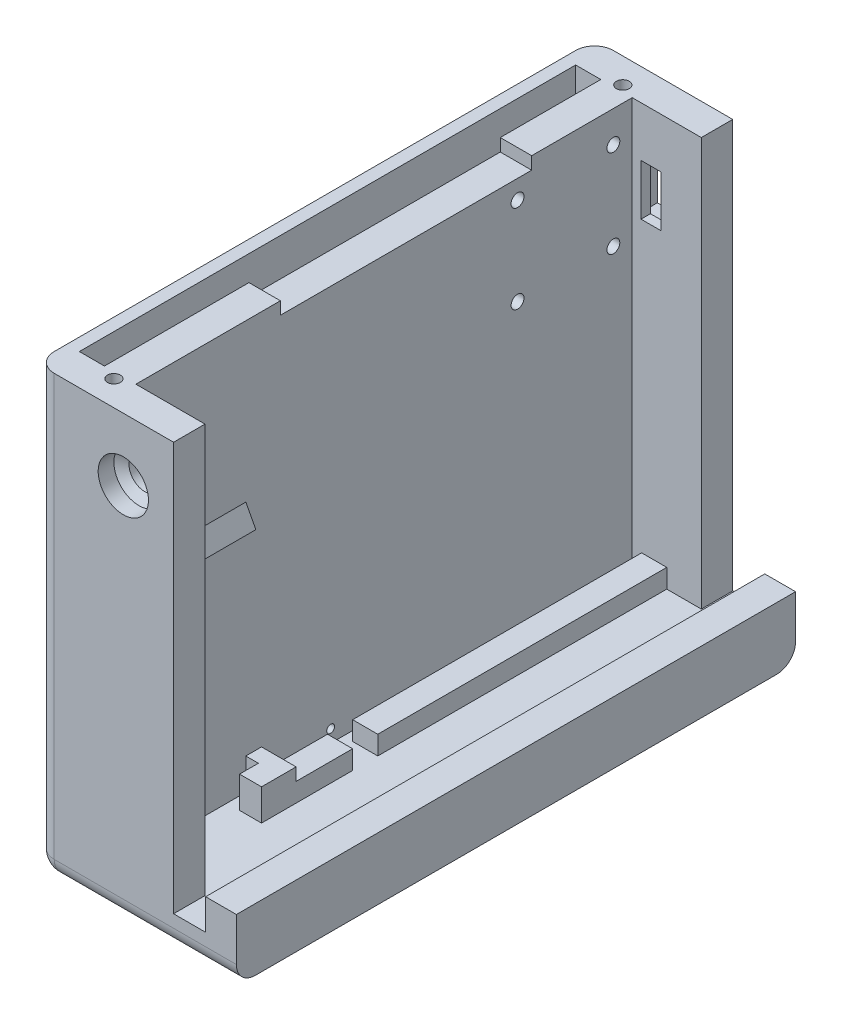
from build123d import *

# Parameters (mm, degrees)
BOSS_EXTRUDE4_DEPTH          = 65
SKETCH5_W                    = 73
SKETCH5_H                    = 7
SKETCH5_H_2                  = 2
BOSS_EXTRUDE5_DEPTH          = 2
CUT_EXTRUDE8_DEPTH           = 111.756489652
CUT_EXTRUDE8_DEPTH_BACK      = 5
SKETCH9_W                    = 5
SKETCH9_H                    = 3
SKETCH9_W_2                  = 2.5
BOSS_EXTRUDE8_DEPTH          = 1.5
SKETCH10_W                   = 66.5
SKETCH10_H                   = 3
BOSS_EXTRUDE9_DEPTH          = 4
M2_5X0_45_TAPPED_HOLE1_D     = 2.05
M2_5X0_45_TAPPED_HOLE1_DEPTH = 3.384117865
M2_5X0_45_TAPPED_HOLE1_TIP   = 0.615882135
SKETCH17_W                   = 11
SKETCH17_H                   = 5
BOSS_EXTRUDE20_DEPTH         = 65
CUT_EXTRUDE10_REACH          = 110.079
SKETCH18_W                   = 8
SKETCH18_H                   = 11
SKETCH20_W                   = 2.5
SKETCH20_H                   = 2
BOSS_EXTRUDE13_DEPTH         = 5.5
SKETCH22_W                   = 3.5
SKETCH22_H                   = 5
BOSS_EXTRUDE21_DEPTH         = 3
SKETCH23_W                   = 3.499642839
SKETCH23_H                   = 5
BOSS_EXTRUDE17_DEPTH         = 3
BOSS_EXTRUDE18_DEPTH         = 17.5
SKETCH27_W                   = 4
SKETCH27_H                   = 3
CUT_EXTRUDE12_DEPTH          = 5.5
M2_5X0_45_TAPPED_HOLE2_D     = 2.05
M2_5X0_45_TAPPED_HOLE2_DEPTH = 4
M2_5X0_45_TAPPED_HOLE2_TIP   = 0.615882135
SKETCH31_W                   = 8
SKETCH31_H                   = 11
SKETCH31_W_2                 = 3.2
SKETCH31_H_2                 = 8.1
BOSS_EXTRUDE22_DEPTH         = 1.5
F_5_0MM_DOWEL_HOLE1_D        = 5
F_5_0MM_DOWEL_HOLE1_DEPTH    = 5
SKETCH36_W                   = 22
SKETCH36_H                   = 89
BOSS_EXTRUDE23_DEPTH         = 5
F_8_0MM_DOWEL_HOLE1_D        = 8
F_8_0MM_DOWEL_HOLE1_DEPTH    = 2.5
F_8_0MM_DOWEL_HOLE1_TIP      = 2.403442476
SKETCH42_W                   = 2
SKETCH42_H                   = 73
BOSS_EXTRUDE25_DEPTH         = 1.5
SKETCH43_W                   = 2
SKETCH43_H                   = 73
CUT_EXTRUDE13_DEPTH          = 1.5
SKETCH44_W                   = 4
SKETCH44_H                   = 79
CUT_EXTRUDE14_DEPTH          = 1.5
SKETCH46_W                   = 5
SKETCH46_H                   = 89
BOSS_EXTRUDE26_DEPTH         = 10
SKETCH46_3_W                 = 5
SKETCH46_3_H                 = 89
BOSS_EXTRUDE27_DEPTH         = 5
FILLET1_R                    = 3
SKETCH47_W                   = 5
SKETCH47_H                   = 89
CUT_EXTRUDE15_DEPTH          = 0.1
SKETCH48_W                   = 89
SKETCH48_H                   = 4.9
CUT_EXTRUDE16_DEPTH          = 0.1


with BuildPart() as part:
    # Sketch4 → Boss-Extrude4 (new body)
    with BuildSketch(Plane(origin=(0, 0, 0), x_dir=(1, 0, 0), z_dir=(0, 1, 0))):
        Polygon((0, 0), (9, 0), (9, 89), (0, 89), (-2, 89), (-2, 81), (0, 81), (0, 84), (4, 84), (4, 5), (0, 5), (0, 8), (-2, 8), (-2, 0), align=None)
    extrude(amount=-BOSS_EXTRUDE4_DEPTH)

    # Sketch5 → Boss-Extrude5 (add)
    with BuildSketch(Plane.ZY.offset(2)):
        with Locations((-44.5, -3.5)):
            Rectangle(SKETCH5_W, SKETCH5_H)
        with Locations((-44.5, -64)):
            Rectangle(SKETCH5_W, SKETCH5_H_2)
    extrude(amount=-BOSS_EXTRUDE5_DEPTH)

    # Sketch8 → Cut-Extrude8 (cut, two sides: drawn at the far end of the back side and taken through both)
    with BuildSketch(Plane(origin=(9, 0, 0), x_dir=(0, 0, -1), z_dir=(1, 0, 0)).offset(-CUT_EXTRUDE8_DEPTH_BACK)):
        Polygon((28, 198.138247042), (28, 0), (28, -2), (68, -2), (68, 0), (68, 198.138247042), (68, 594.414741126), (28, 594.414741126), align=None)
    extrude(amount=CUT_EXTRUDE8_DEPTH + CUT_EXTRUDE8_DEPTH_BACK, mode=Mode.SUBTRACT)

    # Sketch9 → Boss-Extrude8 (add)
    with BuildSketch(Plane(origin=(9, 0, 0), x_dir=(0, 0, -1), z_dir=(1, 0, 0))):
        with Locations((86.5, -63.5)):
            Rectangle(SKETCH9_W, SKETCH9_H)
        with Locations((23.75, -63.5)):
            Rectangle(SKETCH9_W_2, SKETCH9_H)
    extrude(amount=BOSS_EXTRUDE8_DEPTH)

    # Sketch10 → Boss-Extrude9 (add)
    with BuildSketch(Plane(origin=(10.5, 0, 0), x_dir=(0, 0, -1), z_dir=(1, 0, 0))):
        with Locations((55.75, -63.5)):
            Rectangle(SKETCH10_W, SKETCH10_H)
    extrude(amount=BOSS_EXTRUDE9_DEPTH)

    # M2.5x0.45 Tapped Hole1
    with Locations(Plane(origin=(9, 0, 0), x_dir=(0, 0, -1), z_dir=(1, 0, 0))):
        with Locations((81, -5), (65.75, -19), (81, -19), (65.75, -5)):
            Hole(M2_5X0_45_TAPPED_HOLE1_D / 2, depth=M2_5X0_45_TAPPED_HOLE1_DEPTH)
            with Locations((0, 0, -(M2_5X0_45_TAPPED_HOLE1_DEPTH + M2_5X0_45_TAPPED_HOLE1_TIP / 2))):  # 118° drill point
                Cone(0, M2_5X0_45_TAPPED_HOLE1_D / 2, M2_5X0_45_TAPPED_HOLE1_TIP, mode=Mode.SUBTRACT)

    # Sketch17 → Boss-Extrude20 (add)
    with BuildSketch(Plane(origin=(0, 0, 0), x_dir=(1, 0, 0), z_dir=(0, 1, 0))):
        with Locations((14.5, 86.5)):
            Rectangle(SKETCH17_W, SKETCH17_H)
        with Locations((14.5, 2.5)):
            Rectangle(SKETCH17_W, SKETCH17_H)
    extrude(amount=-BOSS_EXTRUDE20_DEPTH)

    # Sketch18 → Cut-Extrude10 (cut, up to next)
    with BuildSketch(Plane.XY.offset(-84), mode=Mode.PRIVATE) as cut_extrude10_sk1:
        with Locations((12, -12)):
            Rectangle(SKETCH18_W, SKETCH18_H)
    cut_extrude10_tool1 = extrude(cut_extrude10_sk1.sketch, amount=-CUT_EXTRUDE10_REACH, mode=Mode.PRIVATE) & part.part
    add(cut_extrude10_tool1.solids().sort_by_distance((12, -12, -84))[0], mode=Mode.SUBTRACT)

    # Sketch20 → Boss-Extrude13 (add)
    with BuildSketch(Plane(origin=(9, 0, 0), x_dir=(0, 0, -1), z_dir=(1, 0, 0))):
        with Locations((23.75, -61)):
            Rectangle(SKETCH20_W, SKETCH20_H)
    extrude(amount=BOSS_EXTRUDE13_DEPTH)

    # Sketch22 → Boss-Extrude21 (add)
    with BuildSketch(Plane.XY.offset(-22.5)):
        with Locations((12.75, -62.5)):
            Rectangle(SKETCH22_W, SKETCH22_H)
    extrude(amount=BOSS_EXTRUDE21_DEPTH)

    # Sketch23 → Boss-Extrude17 (add)
    with BuildSketch(Plane(origin=(0, 0, -5), x_dir=(-1, 0, 0), z_dir=(0, 0, -1))):
        with Locations((-12.74982142, -62.5)):
            Rectangle(SKETCH23_W, SKETCH23_H)
    extrude(amount=BOSS_EXTRUDE17_DEPTH)

    # Sketch24 → Boss-Extrude18 (add)
    with BuildSketch(Plane(origin=(0, 0, -5), x_dir=(-1, 0, 0), z_dir=(0, 0, -1))):
        Polygon((-9, -25), (-10.6, -28), (-9, -28), align=None)
    extrude(amount=BOSS_EXTRUDE18_DEPTH)

    # Sketch25 → M1.6x0.35 Tapped Hole2 (revolve, cut)
    with BuildSketch(Plane(origin=(9, -63, -36), x_dir=(0, 0, -1), z_dir=(0, 1, 0))):
        Polygon((0, 0), (0, 4.375537887), (0.625, 4), (0.625, 0), align=None)
    revolve(axis=Axis((15.35, -63, -36), (-1, 0, 0)), mode=Mode.SUBTRACT)

    # Sketch27 → Cut-Extrude12 (cut)
    with BuildSketch(Plane(origin=(14.5, 0, 0), x_dir=(0, 0, -1), z_dir=(1, 0, 0))):
        with Locations((36, -63.5)):
            Rectangle(SKETCH27_W, SKETCH27_H)
    extrude(amount=-CUT_EXTRUDE12_DEPTH, mode=Mode.SUBTRACT)

    # M2.5x0.45 Tapped Hole2
    with Locations(Plane(origin=(6.5, 0, -4), x_dir=(0, 0, 1), z_dir=(0, 1, 0))):
        with Locations((0, 0), (-81, 0)):
            Hole(M2_5X0_45_TAPPED_HOLE2_D / 2, depth=M2_5X0_45_TAPPED_HOLE2_DEPTH)
            with Locations((0, 0, -(M2_5X0_45_TAPPED_HOLE2_DEPTH + M2_5X0_45_TAPPED_HOLE2_TIP / 2))):  # 118° drill point
                Cone(0, M2_5X0_45_TAPPED_HOLE2_D / 2, M2_5X0_45_TAPPED_HOLE2_TIP, mode=Mode.SUBTRACT)

    # Sketch31 → Boss-Extrude22 (add)
    with BuildSketch(Plane(origin=(0, 0, -84), x_dir=(-1, 0, 0), z_dir=(0, 0, -1))):
        with Locations((-12, -12)):
            Rectangle(SKETCH31_W, SKETCH31_H)
        with Locations((-12, -12)):
            Rectangle(SKETCH31_W_2, SKETCH31_H_2, mode=Mode.SUBTRACT)
    extrude(amount=BOSS_EXTRUDE22_DEPTH)

    # Ø5.0mm Dowel Hole1
    with Locations(Plane(origin=(0, 0, -5), x_dir=(-1, 0, 0), z_dir=(0, 0, -1))):
        with Locations((-12, -10)):
            Hole(F_5_0MM_DOWEL_HOLE1_D / 2, depth=F_5_0MM_DOWEL_HOLE1_DEPTH)

    # Sketch36 → Boss-Extrude23 (add)
    with BuildSketch(Plane.XZ.offset(65)):
        with Locations((9, -44.5)):
            Rectangle(SKETCH36_W, SKETCH36_H)
    extrude(amount=BOSS_EXTRUDE23_DEPTH)

    # Ø8.0mm Dowel Hole1
    with Locations(Plane.XY):
        with Locations((12, -10)):
            Hole(F_8_0MM_DOWEL_HOLE1_D / 2, depth=F_8_0MM_DOWEL_HOLE1_DEPTH)
            with Locations((0, 0, -(F_8_0MM_DOWEL_HOLE1_DEPTH + F_8_0MM_DOWEL_HOLE1_TIP / 2))):  # 118° drill point
                Cone(0, F_8_0MM_DOWEL_HOLE1_D / 2, F_8_0MM_DOWEL_HOLE1_TIP, mode=Mode.SUBTRACT)

    # Sketch42 → Boss-Extrude25 (add)
    with BuildSketch(Plane.XZ.offset(7)):
        with Locations((-1, -44.5)):
            Rectangle(SKETCH42_W, SKETCH42_H)
    extrude(amount=BOSS_EXTRUDE25_DEPTH)

    # Sketch43 → Cut-Extrude13 (cut)
    with BuildSketch(Plane(origin=(0, -63, 0), x_dir=(1, 0, 0), z_dir=(0, 1, 0))):
        with Locations((-1, 44.5)):
            Rectangle(SKETCH43_W, SKETCH43_H)
    extrude(amount=-CUT_EXTRUDE13_DEPTH, mode=Mode.SUBTRACT)

    # Sketch44 → Cut-Extrude14 (cut)
    with BuildSketch(Plane(origin=(0, -65, 0), x_dir=(1, 0, 0), z_dir=(0, 1, 0))):
        with Locations((2, 44.5)):
            Rectangle(SKETCH44_W, SKETCH44_H)
    extrude(amount=-CUT_EXTRUDE14_DEPTH, mode=Mode.SUBTRACT)



with BuildPart() as body_2:
    # Sketch46 → Boss-Extrude26 (new body)
    with BuildSketch(Plane.XZ.offset(70)):
        with Locations((27.5, -44.5)):
            Rectangle(SKETCH46_W, SKETCH46_H)
    extrude(amount=-BOSS_EXTRUDE26_DEPTH)


with BuildPart() as part_1:
    add(part.part)

    add(body_2.part)  # Boss-Extrude27 merges body 2
    # Sketch46<3> → Boss-Extrude27 (add)
    with BuildSketch(Plane.XZ.offset(70)):
        with Locations((22.5, -44.5)):
            Rectangle(SKETCH46_3_W, SKETCH46_3_H)
    extrude(amount=-BOSS_EXTRUDE27_DEPTH)

    # Fillet1
    fillet1_edges = [part_1.edges().sort_by_distance(p)[0] for p in [
        (-2, -35, 0),
        (-2, -35, -89),
        (-2, -70, -44.5),
        (14, -70, -89),
        (14, -70, 0),
    ]]
    fillet(fillet1_edges, radius=FILLET1_R)

    # Sketch47 → Cut-Extrude15 (cut)
    with BuildSketch(Plane(origin=(0, -60, 0), x_dir=(1, 0, 0), z_dir=(0, 1, 0))):
        with Locations((27.5, 44.5)):
            Rectangle(SKETCH47_W, SKETCH47_H)
    extrude(amount=-CUT_EXTRUDE15_DEPTH, mode=Mode.SUBTRACT)

    # Sketch48 → Cut-Extrude16 (cut)
    with BuildSketch(Plane.ZY.offset(-25)):
        with Locations((-44.5, -62.55)):
            Rectangle(SKETCH48_W, SKETCH48_H)
    extrude(amount=-CUT_EXTRUDE16_DEPTH, mode=Mode.SUBTRACT)


solid = part_1.part
